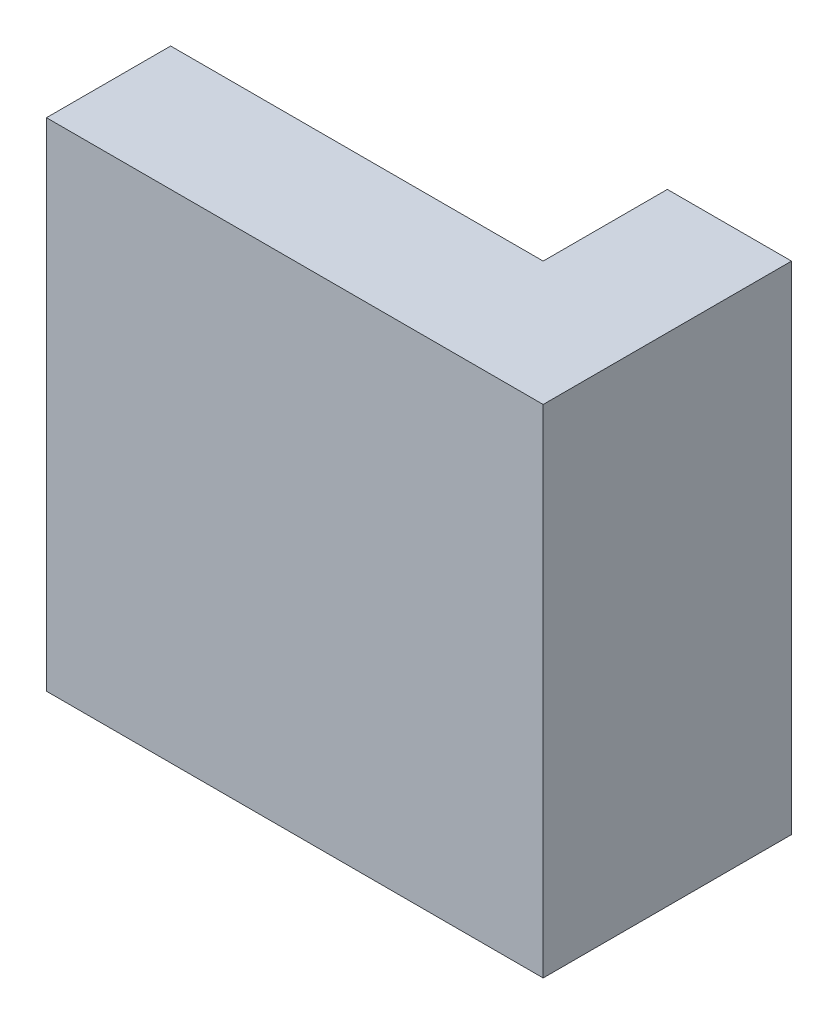
from build123d import *

# Parameters (mm, degrees)
SKETCH1_W           = 12.7
SKETCH1_H           = 3.175
BOSS_EXTRUDE1_DEPTH = 12.7
SKETCH2_W           = 3.175
SKETCH2_H           = 12.7
BOSS_EXTRUDE2_DEPTH = 3.175


with BuildPart() as part:
    # Sketch1 → Boss-Extrude1 (new body)
    with BuildSketch(Plane(origin=(0, 0, 0), x_dir=(1, 0, 0), z_dir=(0, 1, 0))):
        with Locations((6.35, 1.5875)):
            Rectangle(SKETCH1_W, SKETCH1_H)
    extrude(amount=BOSS_EXTRUDE1_DEPTH)

    # Sketch2 → Boss-Extrude2 (add)
    with BuildSketch(Plane(origin=(0, 0, -3.175), x_dir=(-1, 0, 0), z_dir=(0, 0, -1))):
        with Locations((-11.1125, 6.35)):
            Rectangle(SKETCH2_W, SKETCH2_H)
    extrude(amount=BOSS_EXTRUDE2_DEPTH)


solid = part.part
